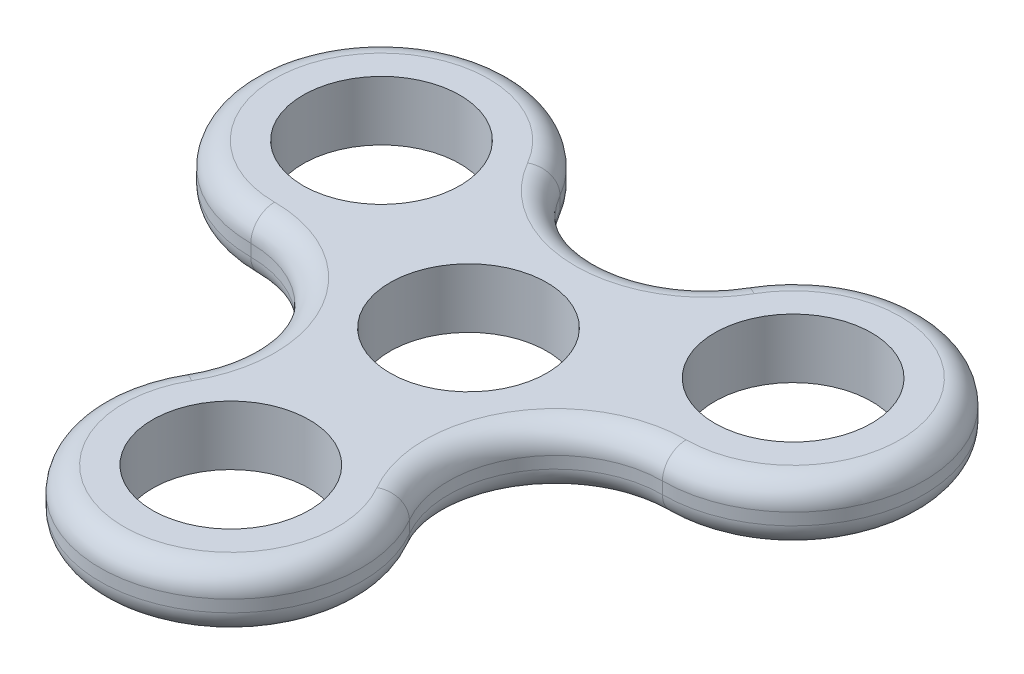
from build123d import *

# Parameters (mm, degrees)
CROQUIS1_R              = 6.6
SALIENTE_EXTRUIR1_DEPTH = 5
REDONDEO1_R             = 2


with BuildPart() as part:
    # Croquis1 → Saliente-Extruir1 (new body)
    with BuildSketch(Plane(origin=(0, 0, 0), x_dir=(1, 0, 0), z_dir=(0, 1, 0))):
        with BuildLine():
            ThreePointArc((17.320508076, -1), (26.846787517, 15.5), (7.794228634, 15.5))
            ThreePointArc((7.794228634, 15.5), (0, 11), (-7.794228634, 15.5))
            ThreePointArc((-7.794228634, 15.5), (-26.846787517, 15.5), (-17.320508076, -1))
            ThreePointArc((-17.320508076, -1), (-9.526279442, -5.5), (-9.526279442, -14.5))
            ThreePointArc((-9.526279442, -14.5), (0, -31), (9.526279442, -14.5))
            ThreePointArc((9.526279442, -14.5), (9.526279442, -5.5), (17.320508076, -1))
        make_face()
        with Locations(Location((0, 0, 0), (0, 0, 270))):
            Circle(CROQUIS1_R, mode=Mode.SUBTRACT)
        with Locations(Location((0, -20, 0), (0, 0, 270))):
            Circle(CROQUIS1_R, mode=Mode.SUBTRACT)
        with Locations(Location((17.320508076, 10, 0), (0, 0, 270))):
            Circle(CROQUIS1_R, mode=Mode.SUBTRACT)
        with Locations(Location((-17.320508076, 10, 0), (0, 0, 270))):
            Circle(CROQUIS1_R, mode=Mode.SUBTRACT)
    extrude(amount=SALIENTE_EXTRUIR1_DEPTH)

    # Redondeo1
    redondeo1_edges = [part.edges().sort_by_distance(p)[0] for p in [
        (-9.526279442, 5, 5.5),
        (0, 5, 31),
        (9.526279442, 5, 5.5),
        (26.846787517, 5, -15.5),
        (0, 5, -11),
        (26.846787517, 0, -15.5),
        (9.526279442, 0, 5.5),
        (0, 0, 31),
        (-26.846787517, 5, -15.5),
        (-9.526279442, 0, 5.5),
        (-26.846787517, 0, -15.5),
        (0, 0, -11),
    ]]
    fillet(redondeo1_edges, radius=REDONDEO1_R)


solid = part.part
